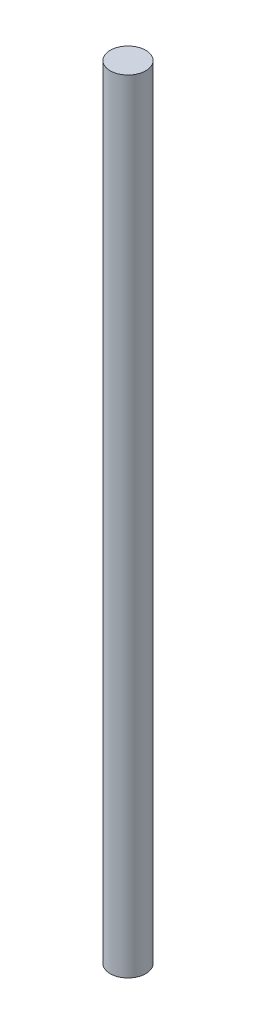
from build123d import *

# Parameters (mm, degrees)
ESBO_O1_R                = 2.5
RESSALTO_EXTRUS_O1_DEPTH = 110


with BuildPart() as part:
    # Esboço1 → Ressalto-extrusão1 (new body)
    with BuildSketch(Plane(origin=(0, 0, 0), x_dir=(1, 0, 0), z_dir=(0, 1, 0))):
        with Locations(Location((0, 0, 0), (0, 0, 270))):
            Circle(ESBO_O1_R)
    extrude(amount=RESSALTO_EXTRUS_O1_DEPTH)


solid = part.part
